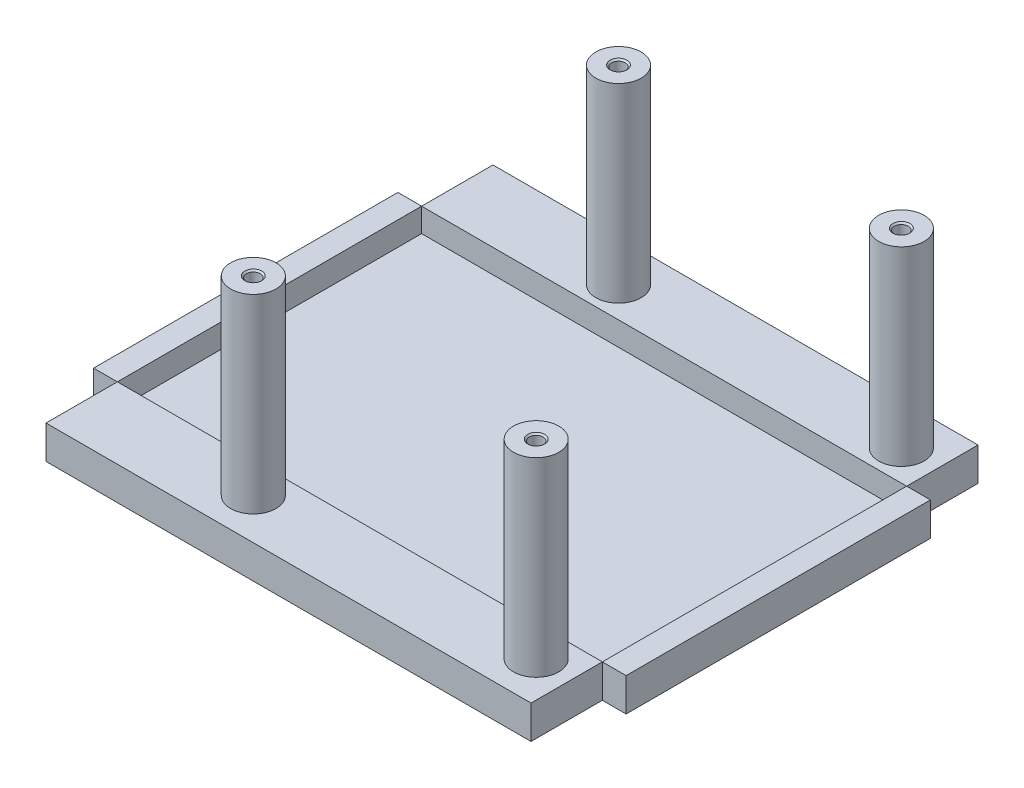
from build123d import *

# Parameters (mm, degrees)
EXTRUDE_7_DEPTH                = 7
SKETCH_3_W                     = 102
SKETCH_3_H                     = 63.98
CUT_EXTRUDE_5_DEPTH            = 5
SKETCH_11_R                    = 4.77
EXTRUDE_8_DEPTH                = 40
HOLE_WIZARD_M3_5_2_D           = 2.9
HOLE_WIZARD_M3_5_2_DEPTH       = 10
HOLE_WIZARD_M3_5_2_CSINK_D     = 3.55
HOLE_WIZARD_M3_5_2_CSINK_ANGLE = 90
HOLE_WIZARD_M3_5_2_TIP         = 0.871247898


with BuildPart() as part:
    # 草图1 → 凸台-拉伸7 (new body)
    with BuildSketch(Plane(origin=(0, 0, 0), x_dir=(1, 0, 0), z_dir=(0, 1, 0))):
        Polygon((0, 64), (0, 79), (102, 79), (102, 64), (107, 64), (107, 0), (102, 0), (102, -15), (0, -15), (0, 0), (-5, 0), (-5, 64), align=None)
    extrude(amount=EXTRUDE_7_DEPTH)

    # 草图3 → 切除-拉伸5 (cut)
    with BuildSketch(Plane(origin=(0, 7, 0), x_dir=(1, 0, 0), z_dir=(0, 1, 0))):
        with Locations((51, 32)):
            Rectangle(SKETCH_3_W, SKETCH_3_H)
    extrude(amount=-CUT_EXTRUDE_5_DEPTH, mode=Mode.SUBTRACT)

    # 草图11 → 凸台-拉伸8 (add)
    with BuildSketch(Plane(origin=(0, 7, 0), x_dir=(1, 0, 0), z_dir=(0, 1, 0))):
        with Locations(Location((35, 70.4, 0), (0, 0, 270))):
            Circle(SKETCH_11_R)
        with Locations(Location((94.484841374, 70.4, 0), (0, 0, 270))):
            Circle(SKETCH_11_R)
        with Locations(Location((94.484841374, -6.4, 0), (0, 0, 90))):
            Circle(SKETCH_11_R)
        with Locations(Location((35, -6.4, 0), (0, 0, 90))):
            Circle(SKETCH_11_R)
    extrude(amount=EXTRUDE_8_DEPTH)

    # M3.5 螺纹孔2
    with Locations(Plane(origin=(35, 47, -70.4), x_dir=(0, 0, 1), z_dir=(0, 1, 0))):
        with Locations((0, 0), (0, 59.484841374), (76.8, 59.484841374), (76.8, 0)):
            CounterSinkHole(HOLE_WIZARD_M3_5_2_D / 2, HOLE_WIZARD_M3_5_2_CSINK_D / 2, depth=HOLE_WIZARD_M3_5_2_DEPTH, counter_sink_angle=HOLE_WIZARD_M3_5_2_CSINK_ANGLE)
            with Locations((0, 0, -(HOLE_WIZARD_M3_5_2_DEPTH + HOLE_WIZARD_M3_5_2_TIP / 2))):  # 118° drill point
                Cone(0, HOLE_WIZARD_M3_5_2_D / 2, HOLE_WIZARD_M3_5_2_TIP, mode=Mode.SUBTRACT)


solid = part.part
